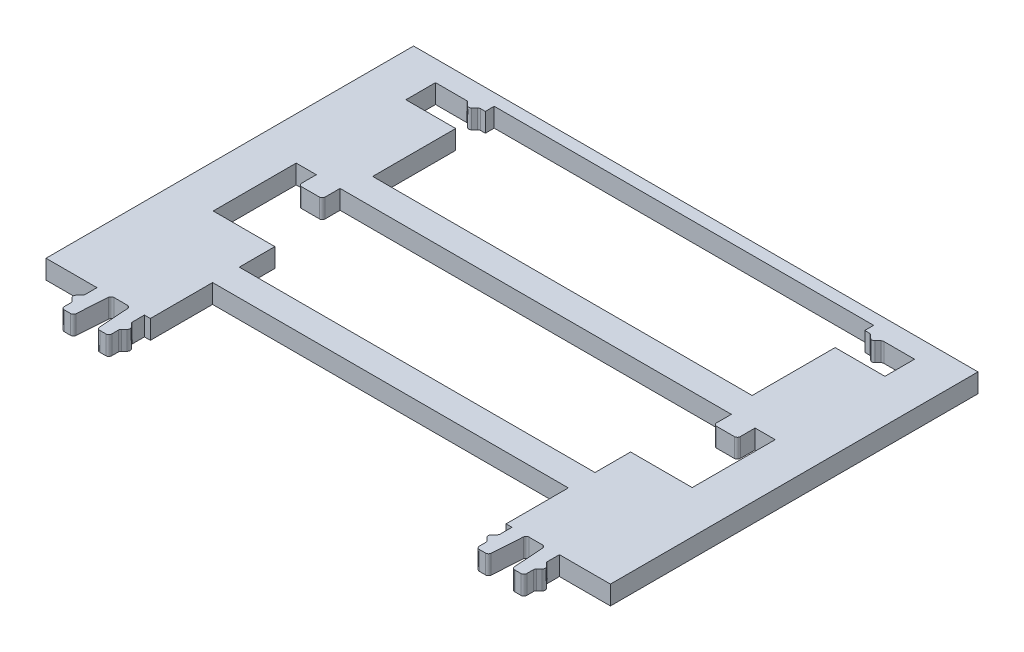
from build123d import *

# Parameters (mm, degrees)
BOSS_EXTRUDE1_DEPTH = 1.6


with BuildPart() as part:
    # Sketch1 → Boss-Extrude1 (new body)
    with BuildSketch(Plane(origin=(0, 0, 0), x_dir=(1, 0, 0), z_dir=(0, 1, 0))):
        with BuildLine():
            Line((-68.929583289, 0), (-64.629583289, 0))
            Line((-64.629583289, 0), (-64.629583289, -0.996446609))
            ThreePointArc((-64.629583289, -0.996446609), (-64.648613406, -1.092117467), (-64.702806594, -1.173223305))
            Line((-64.702806594, -1.173223305), (-64.952806594, -1.423223305))
            ThreePointArc((-64.952806594, -1.423223305), (-65.026029899, -1.6), (-64.952806594, -1.776776695))
            Line((-64.952806594, -1.776776695), (-64.702806594, -2.026776695))
            ThreePointArc((-64.702806594, -2.026776695), (-64.648613406, -2.107882533), (-64.629583289, -2.203553391))
            Line((-64.629583289, -2.203553391), (-64.629583289, -2.75))
            ThreePointArc((-64.629583289, -2.75), (-64.556359984, -2.926776695), (-64.379583289, -3))
            Line((-64.379583289, -3), (-63.863471562, -3))
            ThreePointArc((-63.863471562, -3), (-63.692675541, -2.932561549), (-63.614025273, -2.766629753))
            Line((-63.614025273, -2.766629753), (-63.445141306, -0.233370247))
            ThreePointArc((-63.445141306, -0.233370247), (-63.366491038, -0.067438451), (-63.195695016, 0))
            Line((-63.195695016, 0), (-62.063471562, 0))
            ThreePointArc((-62.063471562, 0), (-61.892675541, -0.067438451), (-61.814025273, -0.233370247))
            Line((-61.814025273, -0.233370247), (-61.645141306, -2.766629753))
            ThreePointArc((-61.645141306, -2.766629753), (-61.566491038, -2.932561549), (-61.395695016, -3))
            Line((-61.395695016, -3), (-60.879583289, -3))
            ThreePointArc((-60.879583289, -3), (-60.702806594, -2.926776695), (-60.629583289, -2.75))
            Line((-60.629583289, -2.75), (-60.629583289, -2.203553391))
            ThreePointArc((-60.629583289, -2.203553391), (-60.610553172, -2.107882533), (-60.556359984, -2.026776695))
            Line((-60.556359984, -2.026776695), (-60.306359984, -1.776776695))
            ThreePointArc((-60.306359984, -1.776776695), (-60.23313668, -1.6), (-60.306359984, -1.423223305))
            Line((-60.306359984, -1.423223305), (-60.556359984, -1.173223305))
            ThreePointArc((-60.556359984, -1.173223305), (-60.610553172, -1.092117467), (-60.629583289, -0.996446609))
            Line((-60.629583289, -0.996446609), (-60.629583289, 0))
            Line((-60.629583289, 0), (-60.129583289, 0))
            Line((-60.129583289, 0), (-60.129583289, 5.25))
            Line((-60.129583289, 5.25), (-45.129583289, 5.25))
            Line((-45.129583289, 5.25), (-45.129583289, 7.5))
            Line((-45.129583289, 7.5), (-60.129583289, 7.5))
            Line((-60.129583289, 7.5), (-60.129583289, 10.5))
            Line((-60.129583289, 10.5), (-65.329583289, 10.5))
            Line((-65.329583289, 10.5), (-65.329583289, 17.5))
            Line((-65.329583289, 17.5), (-63.629583289, 17.5))
            Line((-63.629583289, 17.5), (-63.629583289, 16.25))
            ThreePointArc((-63.629583289, 16.25), (-63.556359984, 16.073223305), (-63.379583289, 16))
            Line((-63.379583289, 16), (-61.879583289, 16))
            ThreePointArc((-61.879583289, 16), (-61.702806594, 16.073223305), (-61.629583289, 16.25))
            Line((-61.629583289, 16.25), (-61.629583289, 17.5))
            Line((-61.629583289, 17.5), (-45.129583289, 17.5))
            Line((-45.129583289, 17.5), (-45.129583289, 19.75))
            Line((-45.129583289, 19.75), (-61.129583289, 19.75))
            Line((-61.129583289, 19.75), (-61.129583289, 26.75))
            Line((-61.129583289, 26.75), (-65.329583289, 26.75))
            Line((-65.329583289, 26.75), (-65.329583289, 29.25))
            Line((-65.329583289, 29.25), (-62.73313668, 29.25))
            ThreePointArc((-62.73313668, 29.25), (-62.637465822, 29.230969883), (-62.556359984, 29.176776695))
            Line((-62.556359984, 29.176776695), (-62.306359984, 28.926776695))
            ThreePointArc((-62.306359984, 28.926776695), (-62.129583289, 28.853553391), (-61.952806594, 28.926776695))
            Line((-61.952806594, 28.926776695), (-61.702806594, 29.176776695))
            ThreePointArc((-61.702806594, 29.176776695), (-61.621700757, 29.230969883), (-61.526029899, 29.25))
            Line((-61.526029899, 29.25), (-61.129583289, 29.25))
            Line((-61.129583289, 29.25), (-61.129583289, 30))
            Line((-61.129583289, 30), (-45.129583289, 30))
            Line((-45.129583289, 30), (-45.129583289, 31))
            Line((-45.129583289, 31), (-68.929583289, 31))
            Line((-68.929583289, 31), (-68.929583289, 20))
            Line((-68.929583289, 20), (-68.929583289, 0))
        make_face()
    boss_extrude1 = extrude(amount=BOSS_EXTRUDE1_DEPTH)

    # Mirror1: Boss-Extrude1 across plane
    add(boss_extrude1.mirror(Plane(origin=(-45.129583289, 1.6, -31), x_dir=(0, 0, 1), z_dir=(-1, 0, 0))))


solid = part.part
